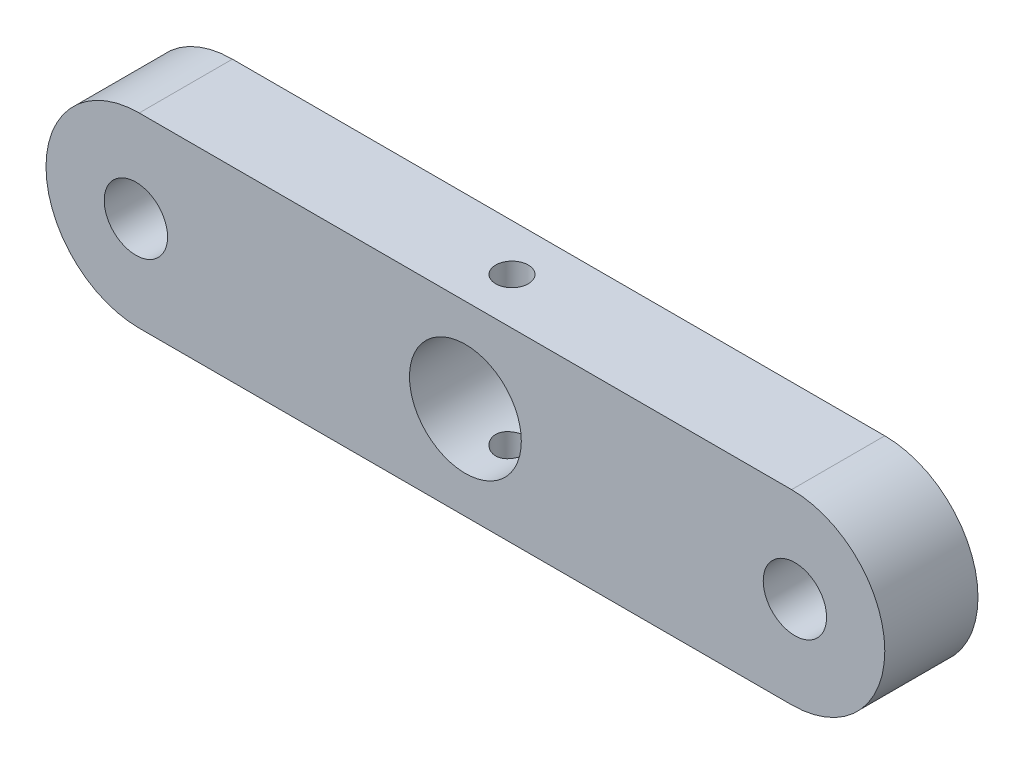
from build123d import *

# Parameters (mm, degrees)
SKETCH16_R                 = 3.4
SKETCH16_R_2               = 6
BOSS_EXTRUDE3_DEPTH        = 10
F_3_5_3_5_DIAMETER_HOLE1_D = 3.5


with BuildPart() as part:
    # Sketch16 → Boss-Extrude3 (new body)
    with BuildSketch(Plane.XY):
        with BuildLine():
            Line((-35, 10), (35, 10))
            ThreePointArc((35, 10), (45, 0), (35, -10))
            Line((35, -10), (-35, -10))
            ThreePointArc((-35, -10), (-45, 0), (-35, 10))
        make_face()
        with Locations((-35.355, 0)):
            Circle(SKETCH16_R, mode=Mode.SUBTRACT)
        Circle(SKETCH16_R_2, mode=Mode.SUBTRACT)
        with Locations(Location((35.355, 0, 0), (0, 0, 180))):
            Circle(SKETCH16_R, mode=Mode.SUBTRACT)
    extrude(amount=BOSS_EXTRUDE3_DEPTH)

    # Ø3.5 (3.5) Diameter Hole1 (through all)
    with Locations(Plane(origin=(0, 10, 0), x_dir=(1, 0, 0), z_dir=(0, 1, 0))):
        with Locations((0, -5)):
            Hole(F_3_5_3_5_DIAMETER_HOLE1_D / 2)


solid = part.part
